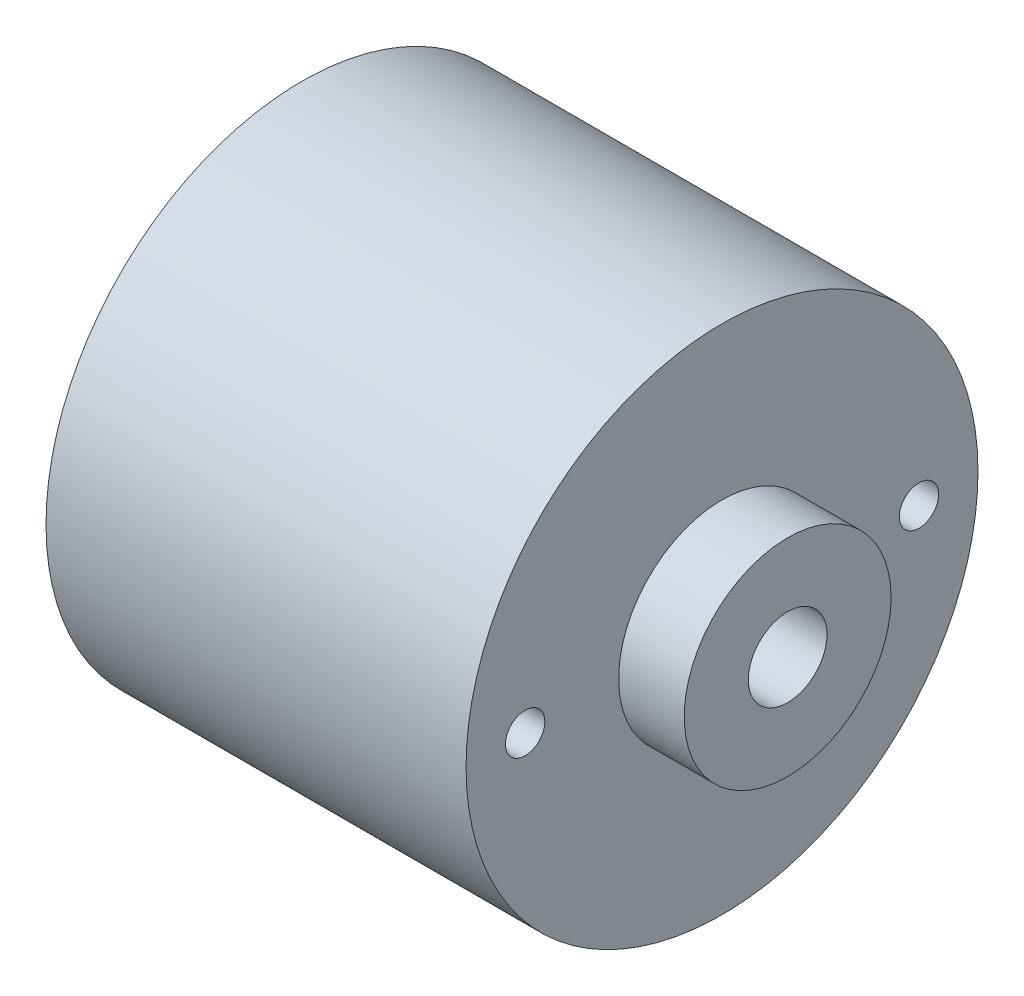
from build123d import *

# Parameters (mm, degrees)
SKETCH_1_R          = 19.5
EXTRUDE_1_DEPTH     = 32
SKETCH_2_R          = 7.88
EXTRUDE_2_DEPTH     = 5
CUT_EXTRUDE_1_REACH = 48.147
SKETCH_3_R          = 3
SKETCH_4_R          = 1.5
CUT_EXTRUDE_2_DEPTH = 10


with BuildPart() as part:
    # 草图1 → 凸台-拉伸1 (new body)
    with BuildSketch(Plane(origin=(0, 0, 0), x_dir=(0, 0, -1), z_dir=(1, 0, 0))):
        Circle(SKETCH_1_R)
    extrude(amount=EXTRUDE_1_DEPTH)

    # 草图2 → 凸台-拉伸2 (add)
    with BuildSketch(Plane(origin=(32, 0, 0), x_dir=(0, 0, -1), z_dir=(1, 0, 0))):
        Circle(SKETCH_2_R)
    extrude(amount=EXTRUDE_2_DEPTH)

    # 草图3 → 切除-拉伸1 (cut, up to next)
    with BuildSketch(Plane(origin=(37, 0, 0), x_dir=(0, 0, -1), z_dir=(1, 0, 0)), mode=Mode.PRIVATE) as cut_extrude_1_sk1:
        Circle(SKETCH_3_R)
    cut_extrude_1_tool1 = extrude(cut_extrude_1_sk1.sketch, amount=-CUT_EXTRUDE_1_REACH, mode=Mode.PRIVATE) & part.part
    add(cut_extrude_1_tool1.solids().sort_by_distance((37, 0, 0))[0], mode=Mode.SUBTRACT)

    # 草图4 → 切除-拉伸2 (cut)
    with BuildSketch(Plane(origin=(32, 0, 0), x_dir=(0, 0, -1), z_dir=(1, 0, 0))):
        with Locations((15, 0)):
            Circle(SKETCH_4_R)
        with Locations((-15, 0)):
            Circle(SKETCH_4_R)
    extrude(amount=-CUT_EXTRUDE_2_DEPTH, mode=Mode.SUBTRACT)


solid = part.part
